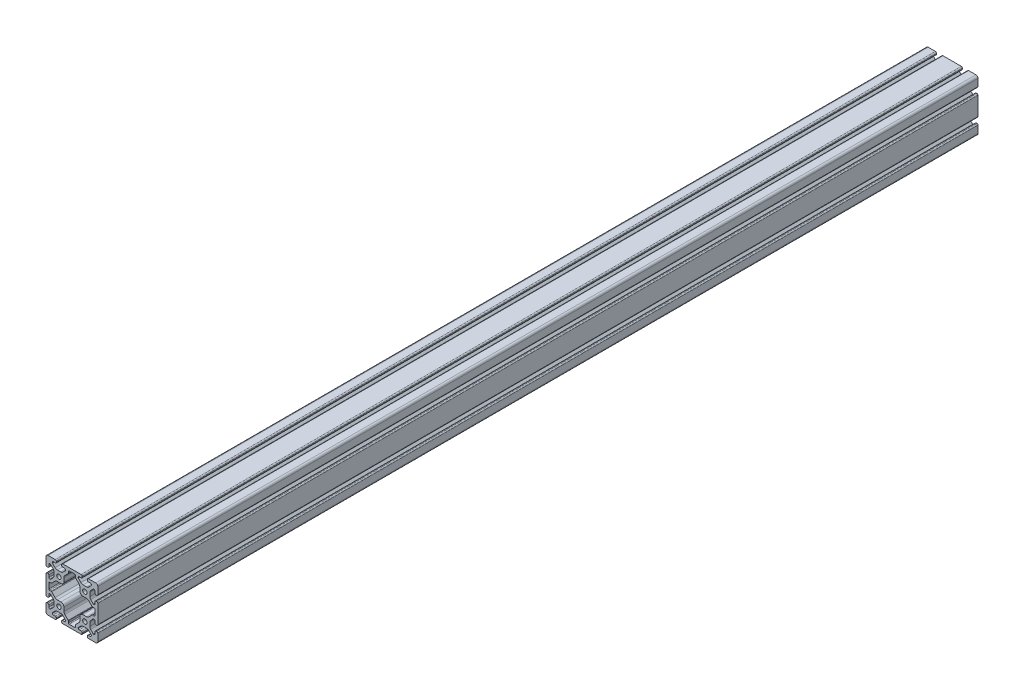
from build123d import *

# Parameters (mm, degrees)
SKETCH1_R      = 3.4
EXTRUDE1_DEPTH = 1360


with BuildPart() as part:
    # Sketch1 → Extrude1 (new body)
    with BuildSketch(Plane.XY):
        with BuildLine():
            Line((29.091242789, 26.036541495), (33.082657296, 30.027956002))
            ThreePointArc((33.082657296, 30.027956002), (33.329219041, 30.192703293), (33.62005845, 30.250554848))
            Line((33.62005845, 30.250554848), (33.955571436, 30.250554848))
            ThreePointArc((33.955571436, 30.250554848), (35.065729082, 29.790712494), (35.525571436, 28.680554848))
            Line((35.525571436, 28.680554848), (35.525571436, 25.777866899))
            ThreePointArc((35.525571436, 25.777866899), (35.985413789, 24.667709253), (37.095571436, 24.207866899))
            Line((37.095571436, 24.207866899), (38.43, 24.207866899))
            ThreePointArc((38.43, 24.207866899), (39.540157646, 24.667709253), (40, 25.777866899))
            Line((40, 25.777866899), (40, 32.933852749))
            Line((40, 32.933852749), (40, 36.83))
            ThreePointArc((40, 36.83), (39.071528496, 39.071528496), (36.83, 40))
            Line((36.83, 40), (25.540851266, 40))
            ThreePointArc((25.540851266, 40), (24.43069362, 39.540157646), (23.970851266, 38.43))
            Line((23.970851266, 38.43), (23.970851266, 37.249043598))
            ThreePointArc((23.970851266, 37.249043598), (24.43069362, 36.138885952), (25.540851266, 35.679043598))
            Line((25.540851266, 35.679043598), (28.625762638, 35.679043598))
            ThreePointArc((28.625762638, 35.679043598), (29.77116849, 35.239363487), (30.250554848, 34.11))
            Line((30.250554848, 34.11), (30.250554848, 33.62005845))
            ThreePointArc((30.250554848, 33.62005845), (30.192703293, 33.329219041), (30.027956002, 33.082657296))
            Line((30.027956002, 33.082657296), (26.036541495, 29.091242789))
            ThreePointArc((26.036541495, 29.091242789), (24.495530588, 28.061572221), (22.677784284, 27.7))
            Line((22.677784284, 27.7), (17.322215716, 27.7))
            ThreePointArc((17.322215716, 27.7), (15.504469412, 28.061572221), (13.963458505, 29.091242789))
            Line((13.963458505, 29.091242789), (9.90393336, 33.150767934))
            ThreePointArc((9.90393336, 33.150767934), (9.764102181, 33.360040084), (9.715, 33.606893415))
            Line((9.715, 33.606893415), (9.715, 34.096834965))
            ThreePointArc((9.715, 34.096834965), (10.178698303, 35.216301697), (11.298165035, 35.68))
            Line((11.298165035, 35.68), (14.642754087, 35.68))
            ThreePointArc((14.642754087, 35.68), (15.560045469, 36.059954531), (15.94, 36.977245913))
            Line((15.94, 36.977245913), (15.94, 38.194841282))
            ThreePointArc((15.94, 38.194841282), (15.411281253, 39.471281253), (14.134841282, 40))
            Line((14.134841282, 40), (6.984433948, 40))
            Line((6.984433948, 40), (-6.984433948, 40))
            Line((-6.984433948, 40), (-14.134841282, 40))
            ThreePointArc((-14.134841282, 40), (-15.411281253, 39.471281253), (-15.94, 38.194841282))
            Line((-15.94, 38.194841282), (-15.94, 36.977245913))
            ThreePointArc((-15.94, 36.977245913), (-15.560045469, 36.059954531), (-14.642754087, 35.68))
            Line((-14.642754087, 35.68), (-11.298165035, 35.68))
            ThreePointArc((-11.298165035, 35.68), (-10.178698303, 35.216301697), (-9.715, 34.096834965))
            Line((-9.715, 34.096834965), (-9.715, 33.606893415))
            ThreePointArc((-9.715, 33.606893415), (-9.764102181, 33.360040084), (-9.90393336, 33.150767934))
            Line((-9.90393336, 33.150767934), (-13.963458505, 29.091242789))
            ThreePointArc((-13.963458505, 29.091242789), (-15.504469412, 28.061572221), (-17.322215716, 27.7))
            Line((-17.322215716, 27.7), (-22.677784284, 27.7))
            ThreePointArc((-22.677784284, 27.7), (-24.495530588, 28.061572221), (-26.036541495, 29.091242789))
            Line((-26.036541495, 29.091242789), (-30.09606664, 33.150767934))
            ThreePointArc((-30.09606664, 33.150767934), (-30.235897819, 33.360040084), (-30.285, 33.606893415))
            Line((-30.285, 33.606893415), (-30.285, 34.096834965))
            ThreePointArc((-30.285, 34.096834965), (-29.821301697, 35.216301697), (-28.701834965, 35.68))
            Line((-28.701834965, 35.68), (-25.357245913, 35.68))
            ThreePointArc((-25.357245913, 35.68), (-24.439954531, 36.059954531), (-24.06, 36.977245913))
            Line((-24.06, 36.977245913), (-24.06, 38.194841282))
            ThreePointArc((-24.06, 38.194841282), (-24.588718747, 39.471281253), (-25.865158718, 40))
            Line((-25.865158718, 40), (-33.031395847, 40))
            Line((-33.031395847, 40), (-36.83, 40))
            ThreePointArc((-36.83, 40), (-39.071528496, 39.071528496), (-40, 36.83))
            Line((-40, 36.83), (-40, 33.318079463))
            Line((-40, 33.318079463), (-40, 25.865158718))
            ThreePointArc((-40, 25.865158718), (-39.471281253, 24.588718747), (-38.194841282, 24.06))
            Line((-38.194841282, 24.06), (-36.977245913, 24.06))
            ThreePointArc((-36.977245913, 24.06), (-36.059954531, 24.439954531), (-35.68, 25.357245913))
            Line((-35.68, 25.357245913), (-35.68, 28.680554848))
            ThreePointArc((-35.68, 28.680554848), (-35.220157646, 29.790712494), (-34.11, 30.250554848))
            Line((-34.11, 30.250554848), (-33.62005845, 30.250554848))
            ThreePointArc((-33.62005845, 30.250554848), (-33.329219041, 30.192703293), (-33.082657296, 30.027956002))
            Line((-33.082657296, 30.027956002), (-29.091242789, 26.036541495))
            ThreePointArc((-29.091242789, 26.036541495), (-28.061572221, 24.495530588), (-27.7, 22.677784284))
            Line((-27.7, 22.677784284), (-27.7, 17.322215716))
            ThreePointArc((-27.7, 17.322215716), (-28.061572221, 15.504469412), (-29.091242789, 13.963458505))
            Line((-29.091242789, 13.963458505), (-33.082657296, 9.972043998))
            ThreePointArc((-33.082657296, 9.972043998), (-33.329219041, 9.807296707), (-33.62005845, 9.749445152))
            Line((-33.62005845, 9.749445152), (-34.11, 9.749445152))
            ThreePointArc((-34.11, 9.749445152), (-35.220157646, 10.209287506), (-35.68, 11.319445152))
            Line((-35.68, 11.319445152), (-35.68, 14.642754087))
            ThreePointArc((-35.68, 14.642754087), (-36.059954531, 15.560045469), (-36.977245913, 15.94))
            Line((-36.977245913, 15.94), (-38.194841282, 15.94))
            ThreePointArc((-38.194841282, 15.94), (-39.471281253, 15.411281253), (-40, 14.134841282))
            Line((-40, 14.134841282), (-40, 7.016888977))
            Line((-40, 7.016888977), (-40, -7.016888977))
            Line((-40, -7.016888977), (-40, -14.447338303))
            ThreePointArc((-40, -14.447338303), (-39.540157646, -15.557495949), (-38.43, -16.017338303))
            Line((-38.43, -16.017338303), (-37.25, -16.017338303))
            ThreePointArc((-37.25, -16.017338303), (-36.139842354, -15.557495949), (-35.68, -14.447338303))
            Line((-35.68, -14.447338303), (-35.68, -11.319445152))
            ThreePointArc((-35.68, -11.319445152), (-35.220157646, -10.209287506), (-34.11, -9.749445152))
            Line((-34.11, -9.749445152), (-33.62005845, -9.749445152))
            ThreePointArc((-33.62005845, -9.749445152), (-33.329219041, -9.807296707), (-33.082657296, -9.972043998))
            Line((-33.082657296, -9.972043998), (-29.091242789, -13.963458505))
            ThreePointArc((-29.091242789, -13.963458505), (-28.061572221, -15.504469412), (-27.7, -17.322215716))
            Line((-27.7, -17.322215716), (-27.7, -22.677784284))
            ThreePointArc((-27.7, -22.677784284), (-28.061572221, -24.495530588), (-29.091242789, -26.036541495))
            Line((-29.091242789, -26.036541495), (-32.871776968, -29.817075674))
            ThreePointArc((-32.871776968, -29.817075674), (-33.10612883, -29.976640176), (-33.382654504, -30.039211548))
            Line((-33.382654504, -30.039211548), (-34.05520779, -30.062697627))
            ThreePointArc((-34.05520779, -30.062697627), (-35.200613642, -29.623017515), (-35.68, -28.493654028))
            Line((-35.68, -28.493654028), (-35.68, -25.59096608))
            ThreePointArc((-35.68, -25.59096608), (-36.139842354, -24.480808433), (-37.25, -24.02096608))
            Line((-37.25, -24.02096608), (-38.43, -24.02096608))
            ThreePointArc((-38.43, -24.02096608), (-39.540157646, -24.480808433), (-40, -25.59096608))
            Line((-40, -25.59096608), (-40, -33.019082273))
            Line((-40, -33.019082273), (-40, -36.83))
            ThreePointArc((-40, -36.83), (-39.071528496, -39.071528496), (-36.83, -40))
            Line((-36.83, -40), (-33, -40))
            Line((-33, -40), (-25.72307469, -40))
            ThreePointArc((-25.72307469, -40), (-24.612917043, -39.540157646), (-24.15307469, -38.43))
            Line((-24.15307469, -38.43), (-24.15307469, -37.25))
            ThreePointArc((-24.15307469, -37.25), (-24.612917043, -36.139842354), (-25.72307469, -35.68))
            Line((-25.72307469, -35.68), (-28.680554848, -35.68))
            ThreePointArc((-28.680554848, -35.68), (-29.790712494, -35.220157646), (-30.250554848, -34.11))
            Line((-30.250554848, -34.11), (-30.250554848, -33.62005845))
            ThreePointArc((-30.250554848, -33.62005845), (-30.192703293, -33.329219041), (-30.027956002, -33.082657296))
            Line((-30.027956002, -33.082657296), (-26.036541495, -29.091242789))
            ThreePointArc((-26.036541495, -29.091242789), (-24.495530588, -28.061572221), (-22.677784284, -27.7))
            Line((-22.677784284, -27.7), (-17.322215716, -27.7))
            ThreePointArc((-17.322215716, -27.7), (-15.504469412, -28.061572221), (-13.963458505, -29.091242789))
            Line((-13.963458505, -29.091242789), (-10.203784275, -32.85091702))
            ThreePointArc((-10.203784275, -32.85091702), (-10.044219772, -33.085268882), (-9.9816484, -33.361794556))
            Line((-9.9816484, -33.361794556), (-9.957433876, -34.05520779))
            ThreePointArc((-9.957433876, -34.05520779), (-10.397113988, -35.200613642), (-11.526477474, -35.68))
            Line((-11.526477474, -35.68), (-14.429165423, -35.68))
            ThreePointArc((-14.429165423, -35.68), (-15.539323069, -36.139842354), (-15.999165423, -37.25))
            Line((-15.999165423, -37.25), (-15.999165423, -38.43))
            ThreePointArc((-15.999165423, -38.43), (-15.539323069, -39.540157646), (-14.429165423, -40))
            Line((-14.429165423, -40), (-6.998716097, -40))
            Line((-6.998716097, -40), (6.998716097, -40))
            Line((6.998716097, -40), (14.424638994, -40))
            ThreePointArc((14.424638994, -40), (15.53479664, -39.540157646), (15.994638994, -38.43))
            Line((15.994638994, -38.43), (15.994638994, -37.032644306))
            ThreePointArc((15.994638994, -37.032644306), (15.53479664, -35.922486659), (14.424638994, -35.462644306))
            Line((14.424638994, -35.462644306), (11.382372282, -35.462644306))
            ThreePointArc((11.382372282, -35.462644306), (10.272214636, -35.002801952), (9.812372282, -33.892644306))
            Line((9.812372282, -33.892644306), (9.812372282, -33.55713132))
            ThreePointArc((9.812372282, -33.55713132), (9.870223837, -33.266291912), (10.034971128, -33.019730166))
            Line((10.034971128, -33.019730166), (13.963458505, -29.091242789))
            ThreePointArc((13.963458505, -29.091242789), (15.504469412, -28.061572221), (17.322215716, -27.7))
            Line((17.322215716, -27.7), (22.677784284, -27.7))
            ThreePointArc((22.677784284, -27.7), (24.495530588, -28.061572221), (26.036541495, -29.091242789))
            Line((26.036541495, -29.091242789), (29.794925243, -32.849626538))
            ThreePointArc((29.794925243, -32.849626538), (29.954489746, -33.083978399), (30.017061118, -33.360504074))
            Line((30.017061118, -33.360504074), (30.041320706, -34.05520779))
            ThreePointArc((30.041320706, -34.05520779), (29.601640594, -35.200613642), (28.472277108, -35.68))
            Line((28.472277108, -35.68), (25.569589159, -35.68))
            ThreePointArc((25.569589159, -35.68), (24.459431513, -36.139842354), (23.999589159, -37.25))
            Line((23.999589159, -37.25), (23.999589159, -38.43))
            ThreePointArc((23.999589159, -38.43), (24.459431513, -39.540157646), (25.569589159, -40))
            Line((25.569589159, -40), (32.999849358, -40))
            Line((32.999849358, -40), (36.83, -40))
            ThreePointArc((36.83, -40), (39.071528496, -39.071528496), (40, -36.83))
            Line((40, -36.83), (40, -33.025941835))
            Line((40, -33.025941835), (40, -25.777866899))
            ThreePointArc((40, -25.777866899), (39.540157646, -24.667709253), (38.43, -24.207866899))
            Line((38.43, -24.207866899), (37.25, -24.207866899))
            ThreePointArc((37.25, -24.207866899), (36.139842354, -24.667709253), (35.68, -25.777866899))
            Line((35.68, -25.777866899), (35.68, -28.680554848))
            ThreePointArc((35.68, -28.680554848), (35.220157646, -29.790712494), (34.11, -30.250554848))
            Line((34.11, -30.250554848), (33.62005845, -30.250554848))
            ThreePointArc((33.62005845, -30.250554848), (33.329219041, -30.192703293), (33.082657296, -30.027956002))
            Line((33.082657296, -30.027956002), (29.091242789, -26.036541495))
            ThreePointArc((29.091242789, -26.036541495), (28.061572221, -24.495530588), (27.7, -22.677784284))
            Line((27.7, -22.677784284), (27.7, -17.322215716))
            ThreePointArc((27.7, -17.322215716), (28.061572221, -15.504469412), (29.091242789, -13.963458505))
            Line((29.091242789, -13.963458505), (33.082657296, -9.972043998))
            ThreePointArc((33.082657296, -9.972043998), (33.329219041, -9.807296707), (33.62005845, -9.749445152))
            Line((33.62005845, -9.749445152), (34.11, -9.749445152))
            ThreePointArc((34.11, -9.749445152), (35.220157646, -10.209287506), (35.68, -11.319445152))
            Line((35.68, -11.319445152), (35.68, -14.222133101))
            ThreePointArc((35.68, -14.222133101), (36.139842354, -15.332290747), (37.25, -15.792133101))
            Line((37.25, -15.792133101), (38.43, -15.792133101))
            ThreePointArc((38.43, -15.792133101), (39.540157646, -15.332290747), (40, -14.222133101))
            Line((40, -14.222133101), (40, -7.021415406))
            Line((40, -7.021415406), (40, 7.021415406))
            Line((40, 7.021415406), (40, 14.222133101))
            ThreePointArc((40, 14.222133101), (39.540157646, 15.332290747), (38.43, 15.792133101))
            Line((38.43, 15.792133101), (37.25, 15.792133101))
            ThreePointArc((37.25, 15.792133101), (36.139842354, 15.332290747), (35.68, 14.222133101))
            Line((35.68, 14.222133101), (35.68, 11.319445152))
            ThreePointArc((35.68, 11.319445152), (35.220157646, 10.209287506), (34.11, 9.749445152))
            Line((34.11, 9.749445152), (33.62005845, 9.749445152))
            ThreePointArc((33.62005845, 9.749445152), (33.329219041, 9.807296707), (33.082657296, 9.972043998))
            Line((33.082657296, 9.972043998), (29.091242789, 13.963458505))
            ThreePointArc((29.091242789, 13.963458505), (28.061572221, 15.504469412), (27.7, 17.322215716))
            Line((27.7, 17.322215716), (27.7, 22.677784284))
            ThreePointArc((27.7, 22.677784284), (28.061572221, 24.495530588), (29.091242789, 26.036541495))
        make_face()
        with Locations((-20, 20)):
            Circle(SKETCH1_R, mode=Mode.SUBTRACT)
        with Locations((20, 20)):
            Circle(SKETCH1_R, mode=Mode.SUBTRACT)
        with Locations((20, -20)):
            Circle(SKETCH1_R, mode=Mode.SUBTRACT)
        with Locations((-20, -20)):
            Circle(SKETCH1_R, mode=Mode.SUBTRACT)
        with BuildLine():
            Line((17.07, 12.32), (22.657784284, 12.32))
            ThreePointArc((22.657784284, 12.32), (24.475530588, 11.958427779), (26.016541495, 10.928757211))
            Line((26.016541495, 10.928757211), (31.143879165, 5.80141954))
            ThreePointArc((31.143879165, 5.80141954), (31.555896818, 5.526118146), (32.041904777, 5.429445152))
            Line((32.041904777, 5.429445152), (34.41, 5.429445152))
            ThreePointArc((34.41, 5.429445152), (35.308025612, 5.057470764), (35.68, 4.159445152))
            Line((35.68, 4.159445152), (35.68, -4.159445152))
            ThreePointArc((35.68, -4.159445152), (35.308025612, -5.057470764), (34.41, -5.429445152))
            Line((34.41, -5.429445152), (32.041904777, -5.429445152))
            ThreePointArc((32.041904777, -5.429445152), (31.555896818, -5.526118146), (31.143879165, -5.80141954))
            Line((31.143879165, -5.80141954), (26.016541495, -10.928757211))
            ThreePointArc((26.016541495, -10.928757211), (24.475530588, -11.958427779), (22.657784284, -12.32))
            Line((22.657784284, -12.32), (17.07, -12.32))
            ThreePointArc((17.07, -12.32), (13.711242789, -13.711242789), (12.32, -17.07))
            Line((12.32, -17.07), (12.32, -22.657784284))
            ThreePointArc((12.32, -22.657784284), (11.958427779, -24.475530588), (10.928757211, -26.016541495))
            Line((10.928757211, -26.016541495), (5.80141954, -31.143879165))
            ThreePointArc((5.80141954, -31.143879165), (5.526118146, -31.555896818), (5.429445152, -32.041904777))
            Line((5.429445152, -32.041904777), (5.429445152, -34.41))
            ThreePointArc((5.429445152, -34.41), (5.057470764, -35.308025612), (4.159445152, -35.68))
            Line((4.159445152, -35.68), (-4.159445152, -35.68))
            ThreePointArc((-4.159445152, -35.68), (-5.057470764, -35.308025612), (-5.429445152, -34.41))
            Line((-5.429445152, -34.41), (-5.429445152, -32.041904777))
            ThreePointArc((-5.429445152, -32.041904777), (-5.526118146, -31.555896818), (-5.80141954, -31.143879165))
            Line((-5.80141954, -31.143879165), (-10.928757211, -26.016541495))
            ThreePointArc((-10.928757211, -26.016541495), (-11.958427779, -24.475530588), (-12.32, -22.657784284))
            Line((-12.32, -22.657784284), (-12.32, -17.07))
            ThreePointArc((-12.32, -17.07), (-13.711242789, -13.711242789), (-17.07, -12.32))
            Line((-17.07, -12.32), (-22.657784284, -12.32))
            ThreePointArc((-22.657784284, -12.32), (-24.475530588, -11.958427779), (-26.016541495, -10.928757211))
            Line((-26.016541495, -10.928757211), (-31.143879165, -5.80141954))
            ThreePointArc((-31.143879165, -5.80141954), (-31.555896818, -5.526118146), (-32.041904777, -5.429445152))
            Line((-32.041904777, -5.429445152), (-34.41, -5.429445152))
            ThreePointArc((-34.41, -5.429445152), (-35.308025612, -5.057470764), (-35.68, -4.159445152))
            Line((-35.68, -4.159445152), (-35.68, 4.159445152))
            ThreePointArc((-35.68, 4.159445152), (-35.308025612, 5.057470764), (-34.41, 5.429445152))
            Line((-34.41, 5.429445152), (-32.041904777, 5.429445152))
            ThreePointArc((-32.041904777, 5.429445152), (-31.555896818, 5.526118146), (-31.143879165, 5.80141954))
            Line((-31.143879165, 5.80141954), (-26.016541495, 10.928757211))
            ThreePointArc((-26.016541495, 10.928757211), (-24.475530588, 11.958427779), (-22.657784284, 12.32))
            Line((-22.657784284, 12.32), (-17.07, 12.32))
            ThreePointArc((-17.07, 12.32), (-13.711242789, 13.711242789), (-12.32, 17.07))
            Line((-12.32, 17.07), (-12.32, 22.657784284))
            ThreePointArc((-12.32, 22.657784284), (-11.958427779, 24.475530588), (-10.928757211, 26.016541495))
            Line((-10.928757211, 26.016541495), (-5.80141954, 31.143879165))
            ThreePointArc((-5.80141954, 31.143879165), (-5.526118146, 31.555896818), (-5.429445152, 32.041904777))
            Line((-5.429445152, 32.041904777), (-5.429445152, 34.41))
            ThreePointArc((-5.429445152, 34.41), (-5.057470764, 35.308025612), (-4.159445152, 35.68))
            Line((-4.159445152, 35.68), (4.159445152, 35.68))
            ThreePointArc((4.159445152, 35.68), (5.057470764, 35.308025612), (5.429445152, 34.41))
            Line((5.429445152, 34.41), (5.429445152, 32.041904777))
            ThreePointArc((5.429445152, 32.041904777), (5.526118146, 31.555896818), (5.80141954, 31.143879165))
            Line((5.80141954, 31.143879165), (10.928757211, 26.016541495))
            ThreePointArc((10.928757211, 26.016541495), (11.958427779, 24.475530588), (12.32, 22.657784284))
            Line((12.32, 22.657784284), (12.32, 17.07))
            ThreePointArc((12.32, 17.07), (13.711242789, 13.711242789), (17.07, 12.32))
        make_face(mode=Mode.SUBTRACT)
    extrude(amount=-EXTRUDE1_DEPTH)


solid = part.part
